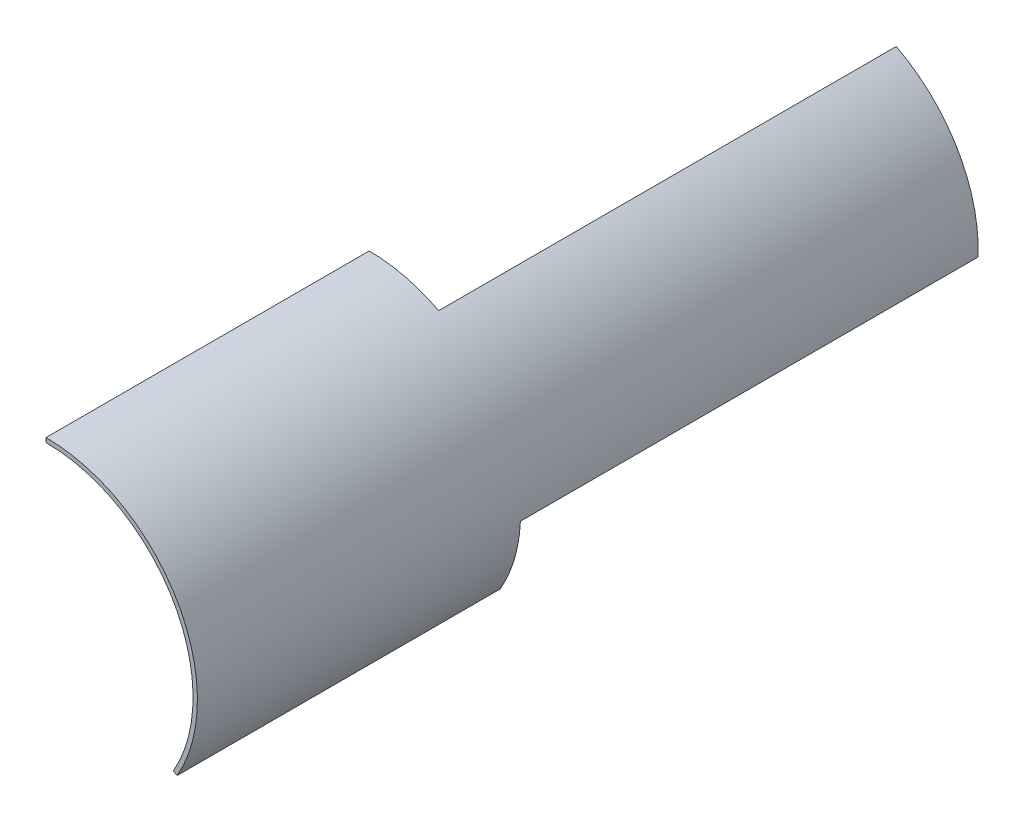
from build123d import *

# Parameters (mm, degrees)
REVOLVE_1_ANGLE           = 120.00000000000027
REVOLVE_2_ANGLE           = 33.00000000000007
REVOLVE_2_OTHER_WAY_ANGLE = 33.00000000000007
CUT_EXTRUDE_4_DEPTH       = 126
CUT_EXTRUDE_5_DEPTH       = 126


with BuildPart() as part:
    # Эскиз1 → Повернуть1 (revolve)
    with BuildSketch(Plane(origin=(0, 0, 0), x_dir=(0, 0, -1), z_dir=(1, 0, 0))):
        Polygon((-2e-17, 41.7), (-4.23e-15, 40.5), (89, 40.5), (89, 41.70000000000002), align=None)
    revolve(axis=Axis((0, 0, 0), (0, 0, -1)), revolution_arc=REVOLVE_1_ANGLE)

    # Эскиз3 → Повернуть2 (revolve)
    with BuildSketch(Plane(origin=(0, 0, 0), x_dir=(0, 0, 1), z_dir=(0.499999999999998, -0.8660254037844398, 0))):
        Polygon((-89, -40.5), (-215, -40.500000000000014), (-215, -41.70000000000002), (-89, -41.700000000000024), align=None)
    revolve(axis=Axis((0, 0, -89), (0, 0, 1)), revolution_arc=REVOLVE_2_ANGLE)

    # Эскиз3 → Повернуть2 other way (revolve)
    with BuildSketch(Plane(origin=(0, 0, 0), x_dir=(0, 0, 1), z_dir=(0.499999999999998, -0.8660254037844398, 0))):
        Polygon((-89, -40.5), (-215, -40.500000000000014), (-215, -41.70000000000002), (-89, -41.700000000000024), align=None)
    revolve(axis=Axis((0, 0, -89), (0, 0, -1)), revolution_arc=REVOLVE_2_OTHER_WAY_ANGLE)

    # Эскиз5 → Вырез-Вытянуть4 (cut)
    with BuildSketch(Plane(origin=(0, 0, -215), x_dir=(-1, 0, 0), z_dir=(0, 0, -1))):
        Polygon((-41.65518715609019, -1.9327138927169163), (-39.93832529078865, -1.4726821423935714), (-38.91609393559994, -3.4834404042625358), (-41.909594866084106, -3.6461306722236317), align=None)
    extrude(amount=-CUT_EXTRUDE_4_DEPTH, mode=Mode.SUBTRACT)

    # Эскиз6 → Вырез-Вытянуть5 (cut)
    with BuildSketch(Plane(origin=(0, 0, -215), x_dir=(-1, 0, 0), z_dir=(0, 0, -1))):
        Polygon((-18.830708808502447, 35.8560232843715), (-19.80637583241834, 39.49726218889504), (-16.068176634900343, 39.433464562570705), (-15.316320189263505, 34.07013113552305), align=None)
    extrude(amount=-CUT_EXTRUDE_5_DEPTH, mode=Mode.SUBTRACT)


solid = part.part
